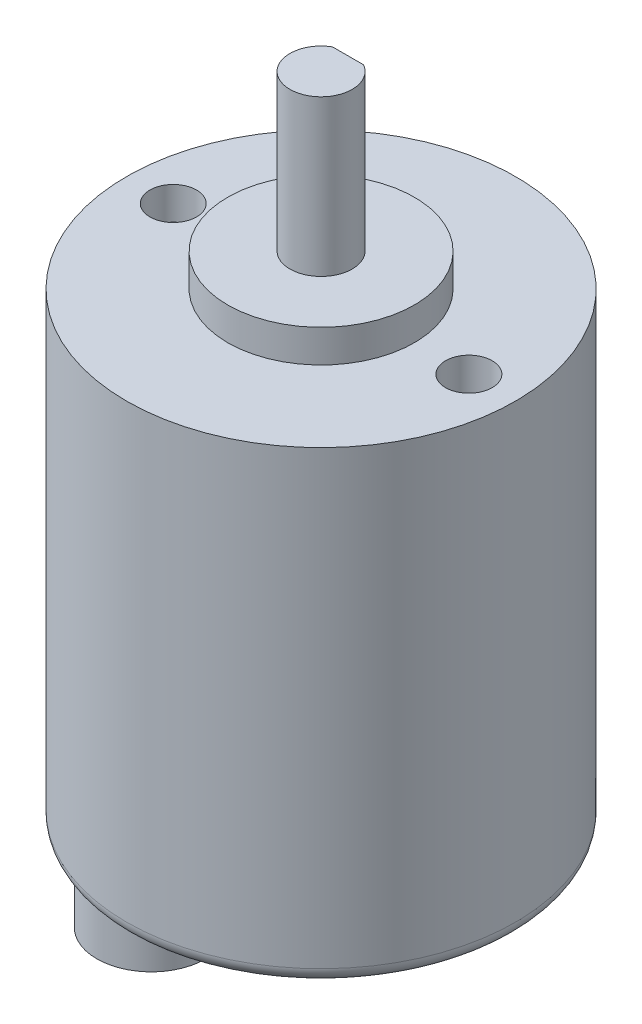
from build123d import *

# Parameters (mm, degrees)
SKETCH_1_R          = 12.5
EXTRUDE_1_DEPTH     = 30
FILLET_1_R          = 1
SKETCH_2_R          = 6
EXTRUDE_2_DEPTH     = 2.1
SKETCH_3_R          = 1.5
CUT_EXTRUDE_1_DEPTH = 2.1
SKETCH_4_R          = 2
EXTRUDE_3_DEPTH     = 10
CUT_EXTRUDE_START   = -7
CUT_EXTRUDE_2_DEPTH = 7
SKETCH_6_R          = 3.5
EXTRUDE_4_DEPTH     = 7


with BuildPart() as part:
    # 草图1 → 凸台-拉伸1 (new body)
    with BuildSketch(Plane(origin=(0, 0, 0), x_dir=(1, 0, 0), z_dir=(0, 1, 0))):
        with Locations(Location((0, 0, 0), (0, 0, 270))):
            Circle(SKETCH_1_R)
    extrude(amount=EXTRUDE_1_DEPTH)

    # 圆角1
    fillet_1_edges = [part.edges().sort_by_distance(p)[0] for p in [
        (0, 0, -12.5),
    ]]
    fillet(fillet_1_edges, radius=FILLET_1_R)

    # 草图2 → 凸台-拉伸2 (add)
    with BuildSketch(Plane(origin=(0, 30, 0), x_dir=(1, 0, 0), z_dir=(0, 1, 0))):
        with Locations(Location((0, 0, 0), (0, 0, 270))):
            Circle(SKETCH_2_R)
    extrude(amount=EXTRUDE_2_DEPTH)

    # 草图3 → 切除-拉伸1 (cut)
    with BuildSketch(Plane(origin=(0, 30, 0), x_dir=(1, 0, 0), z_dir=(0, 1, 0))):
        with Locations(Location((-9.5, 0, 0), (0, 0, 270))):
            Circle(SKETCH_3_R)
        with Locations(Location((9.5, 0, 0), (0, 0, 270))):
            Circle(SKETCH_3_R)
    extrude(amount=-CUT_EXTRUDE_1_DEPTH, mode=Mode.SUBTRACT)

    # 草图4 → 凸台-拉伸3 (add)
    with BuildSketch(Plane(origin=(0, 32.1, 0), x_dir=(1, 0, 0), z_dir=(0, 1, 0))):
        with Locations(Location((0, 0, 0), (0, 0, 270))):
            Circle(SKETCH_4_R)
    extrude(amount=EXTRUDE_3_DEPTH)

    # 草图5 → 切除-拉伸2 (cut)
    with BuildSketch(Plane(origin=(0, 42.1, 0), x_dir=(1, 0, 0), z_dir=(0, 1, 0)).offset(CUT_EXTRUDE_START)):
        with BuildLine():
            Line((-0.99729895, 1.733607454), (0.99729895, 1.733607454))
            ThreePointArc((0.99729895, 1.733607454), (0, 2), (-0.99729895, 1.733607454))
        make_face()
    extrude(amount=CUT_EXTRUDE_2_DEPTH, mode=Mode.SUBTRACT)

    # 草图6 → 凸台-拉伸4 (add)
    with BuildSketch(Plane.XZ):
        with Locations(Location((-6.913670465, 3.996713823, 0), (0, 0, 90))):
            Circle(SKETCH_6_R)
    extrude(amount=EXTRUDE_4_DEPTH)


solid = part.part
